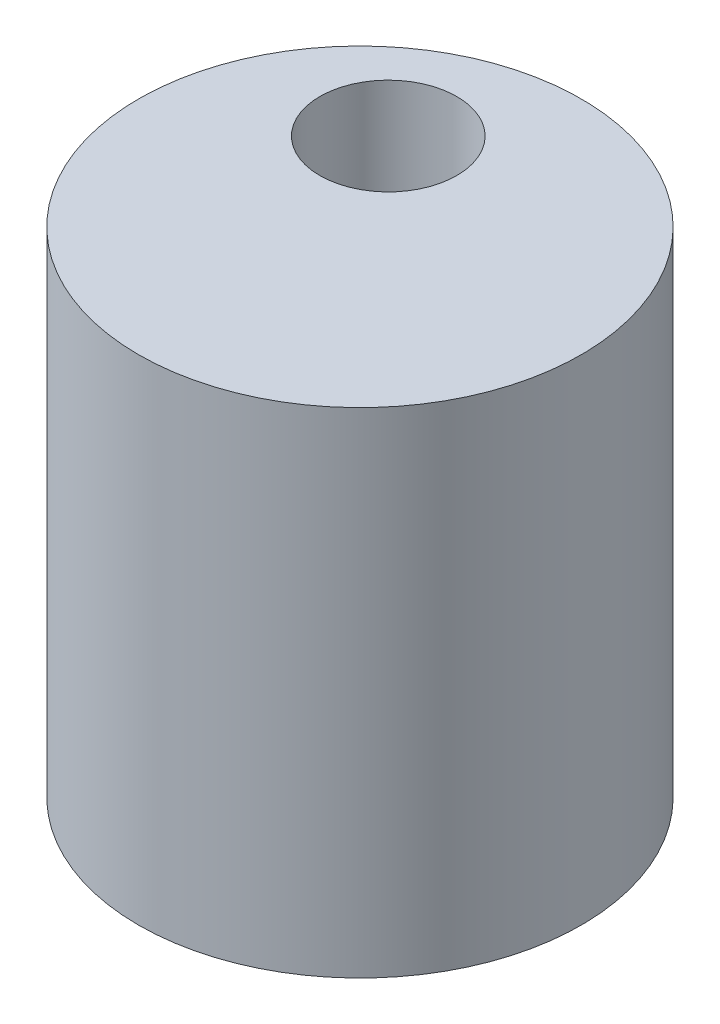
from build123d import *

# Parameters (mm, degrees)
SKETCH1_R           = 13.0937
SKETCH1_R_2         = 4.05
BOSS_EXTRUDE1_DEPTH = 29.21


with BuildPart() as part:
    # Sketch1 → Boss-Extrude1 (new body)
    with BuildSketch(Plane(origin=(0, 0, 0), x_dir=(1, 0, 0), z_dir=(0, 1, 0))):
        with Locations(Location((0, 0, 0), (0, 0, 270))):
            Circle(SKETCH1_R)
        with Locations(Location((-3.81, 5.4864, 0), (0, 0, 270))):
            Circle(SKETCH1_R_2, mode=Mode.SUBTRACT)
    extrude(amount=-BOSS_EXTRUDE1_DEPTH)


solid = part.part
